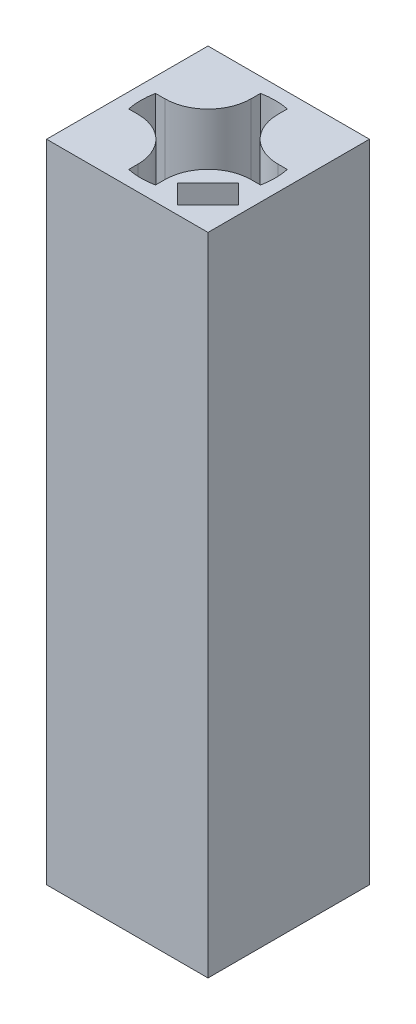
from build123d import *

# Parameters (mm, degrees)
SKETCH_1_W          = 30
SKETCH_1_H          = 30
EXTRUDE_1_DEPTH     = 120
SKETCH_2_W          = 9.747448714
SKETCH_2_H          = 5
SKETCH_2_W_2        = 5
SKETCH_2_H_2        = 9.747448714
CUT_EXTRUDE_1_DEPTH = 100
FILLET_1_R          = 8
CUT_EXTRUDE_2_DEPTH = 10


with BuildPart() as part:
    # 草图1 → 凸台-拉伸1 (new body)
    with BuildSketch(Plane(origin=(0, 0, 0), x_dir=(1, 0, 0), z_dir=(0, 1, 0))):
        Rectangle(SKETCH_1_W, SKETCH_1_H)
    extrude(amount=EXTRUDE_1_DEPTH)

    # 草图2 → 切除-拉伸1 (cut)
    with BuildSketch(Plane(origin=(0, 120, 0), x_dir=(1, 0, 0), z_dir=(0, 1, 0))):
        with Locations((-7.373724357, 0)):
            Rectangle(SKETCH_2_W, SKETCH_2_H)
        Rectangle(SKETCH_2_W_2, SKETCH_2_H)
        with Locations((0, -7.373724357)):
            Rectangle(SKETCH_2_W_2, SKETCH_2_H_2)
        with Locations((7.373724357, 0)):
            Rectangle(SKETCH_2_W, SKETCH_2_H)
        with Locations((0, 7.373724357)):
            Rectangle(SKETCH_2_W_2, SKETCH_2_H_2)
        with BuildLine():
            ThreePointArc((-12.247448714, 2.5), (-12.5, 0), (-12.247448714, -2.5))
            Line((-12.247448714, -2.5), (-12.247448714, 2.5))
        make_face()
        with BuildLine():
            ThreePointArc((2.5, 12.247448714), (0, 12.5), (-2.5, 12.247448714))
            Line((-2.5, 12.247448714), (2.5, 12.247448714))
        make_face()
        with BuildLine():
            Line((12.247448714, 2.5), (12.247448714, -2.5))
            ThreePointArc((12.247448714, -2.5), (12.436701913, -1.256362025), (12.5, 0))
            ThreePointArc((12.5, 0), (12.436701913, 1.256362025), (12.247448714, 2.5))
        make_face()
        with BuildLine():
            Line((2.5, -12.247448714), (-2.5, -12.247448714))
            ThreePointArc((-2.5, -12.247448714), (0, -12.5), (2.5, -12.247448714))
        make_face()
    extrude(amount=-CUT_EXTRUDE_1_DEPTH, mode=Mode.SUBTRACT)

    # 圆角1
    fillet_1_edges = [part.edges().sort_by_distance(p)[0] for p in [
        (-2.5, 70, -2.5),
        (2.5, 70, -2.5),
        (2.5, 70, 2.5),
        (-2.5, 70, 2.5),
    ]]
    fillet(fillet_1_edges, radius=FILLET_1_R)

    # 草图4 → 切除-拉伸2 (cut)
    with BuildSketch(Plane(origin=(0, 120, 0), x_dir=(1, 0, 0), z_dir=(0, 1, 0))):
        Polygon((4.254858786, -9.911713035), (9.911713035, -4.254858786), (13.447246941, -7.790392692), (7.790392692, -13.447246941), align=None)
    extrude(amount=-CUT_EXTRUDE_2_DEPTH, mode=Mode.SUBTRACT)


solid = part.part
